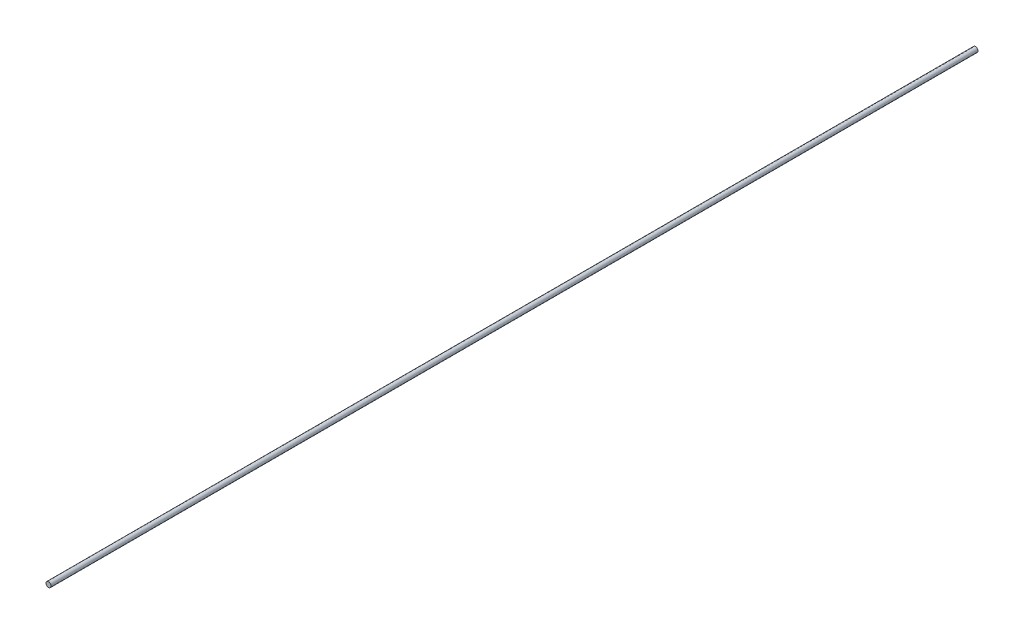
from build123d import *

# Parameters (mm, degrees)
SKETCH1_R           = 1.25
BOSS_EXTRUDE1_DEPTH = 460


with BuildPart() as part:
    # Sketch1 → Boss-Extrude1 (new body)
    with BuildSketch(Plane.XY):
        Circle(SKETCH1_R)
    extrude(amount=BOSS_EXTRUDE1_DEPTH)


solid = part.part
